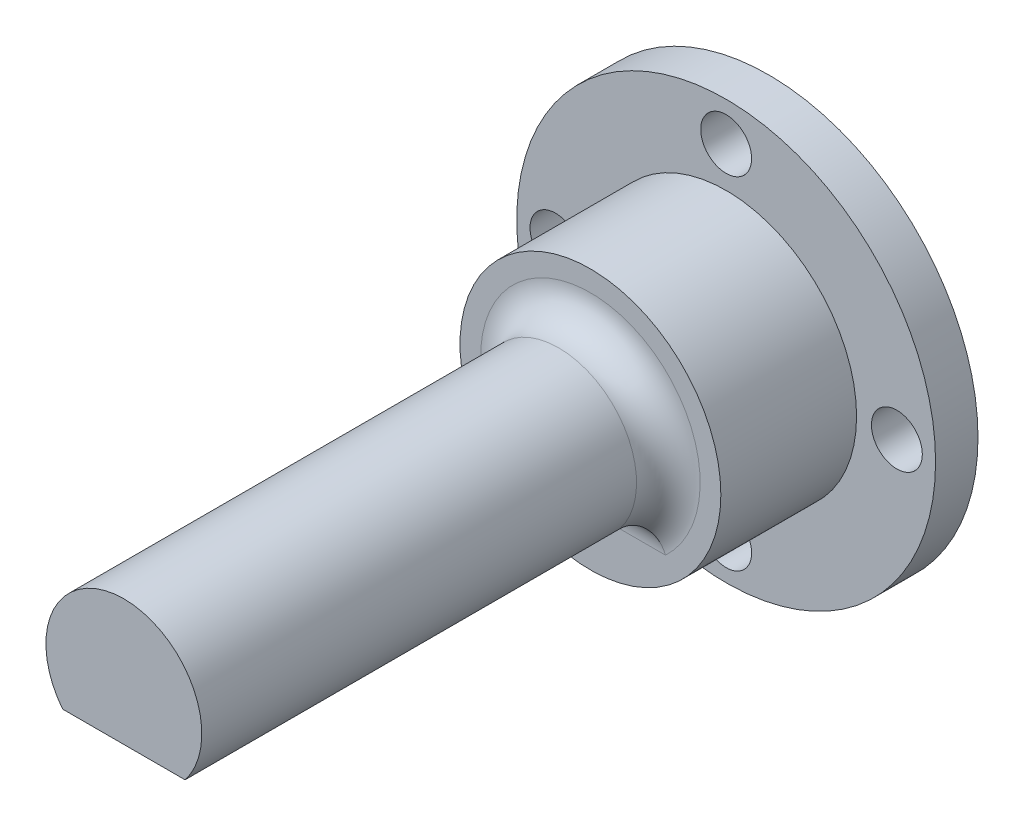
from build123d import *

# Parameters (mm, degrees)
ESQUISSE1_R             = 9.875
BOSS_EXTRU_1_DEPTH      = 2
ESQUISSE2_R             = 6.15
BOSS_EXTRU_2_DEPTH      = 6.4
ESQUISSE3_R             = 3.675
BOSS_EXTRU_3_DEPTH      = 22
ENL_V_START             = -22
ENL_V_MAT_EXTRU_1_DEPTH = 22
ESQUISSE5_R             = 1.2
ENL_V_MAT_EXTRU_2_DEPTH = 32.647926472
CONG_1_R                = 1.5


with BuildPart() as part:
    # Esquisse1 → Boss.-Extru.1 (new body)
    with BuildSketch(Plane.XY):
        Circle(ESQUISSE1_R)
    extrude(amount=BOSS_EXTRU_1_DEPTH)

    # Esquisse2 → Boss.-Extru.2 (add)
    with BuildSketch(Plane.XY.offset(2)):
        Circle(ESQUISSE2_R)
    extrude(amount=BOSS_EXTRU_2_DEPTH)

    # Esquisse3 → Boss.-Extru.3 (add)
    with BuildSketch(Plane.XY.offset(8.4)):
        Circle(ESQUISSE3_R)
    extrude(amount=BOSS_EXTRU_3_DEPTH)

    # Esquisse4 → Enlèv. mat.-Extru.1 (cut)
    with BuildSketch(Plane.XY.offset(30.4).offset(ENL_V_START)):
        with BuildLine():
            Line((-2.886173938, -2.275), (2.886173938, -2.275))
            ThreePointArc((2.886173938, -2.275), (0, -3.675), (-2.886173938, -2.275))
        make_face()
    extrude(amount=ENL_V_MAT_EXTRU_1_DEPTH, mode=Mode.SUBTRACT)

    # Esquisse5 → Enlèv. mat.-Extru.2 (cut, through all)
    with BuildSketch(Plane.XY.offset(2)):
        with Locations((0, 8.045346172)):
            Circle(ESQUISSE5_R)
        with Locations((0, -8.054653828)):
            Circle(ESQUISSE5_R)
        with Locations((-8.05, 0)):
            Circle(ESQUISSE5_R)
        with Locations((8.05, 0)):
            Circle(ESQUISSE5_R)
    extrude(amount=-ENL_V_MAT_EXTRU_2_DEPTH, mode=Mode.SUBTRACT)

    # Congé1
    cong_1_edges = [part.edges().sort_by_distance(p)[0] for p in [
        (0, 3.675, 8.4),
        (0, -2.275, 8.4),
    ]]
    fillet(cong_1_edges, radius=CONG_1_R)


solid = part.part
